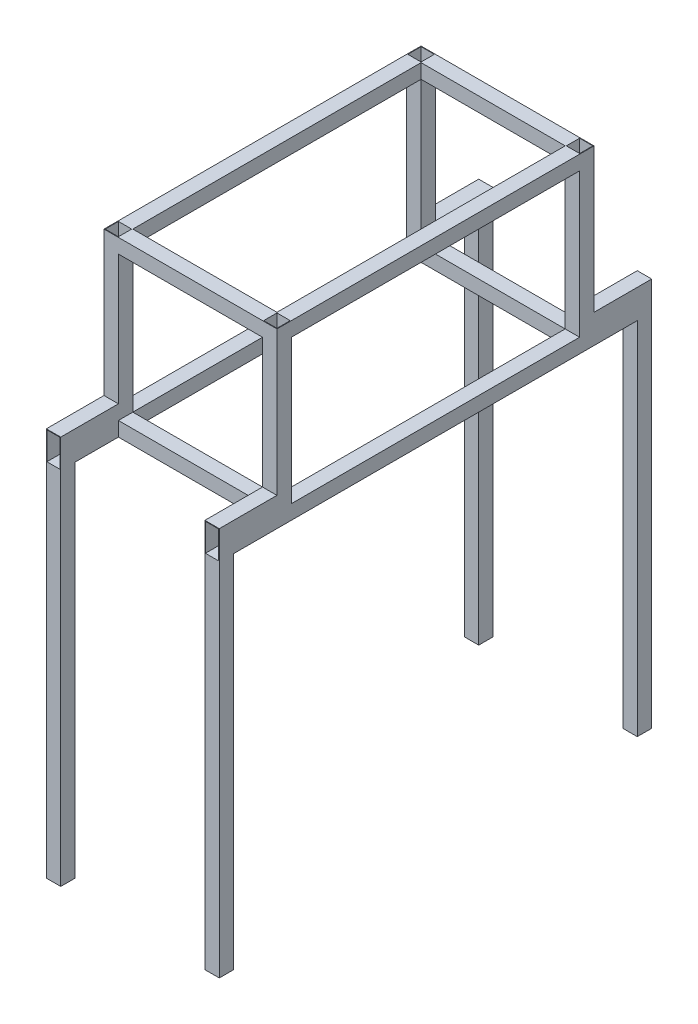
from build123d import *

# Parameters (mm, degrees)
SKETCH1_W             = 25.4
SKETCH1_H             = 25.4
SKETCH1_W_2           = 23.4
SKETCH1_H_2           = 23.4
BOSS_EXTRUDE1_DEPTH   = 304.8
BOSS_EXTRUDE1_2_DEPTH = 304.8
BOSS_EXTRUDE1_3_DEPTH = 304.8
BOSS_EXTRUDE1_4_DEPTH = 304.8
SKETCH2_W             = 25.4
SKETCH2_H             = 25.4
SKETCH2_W_2           = 23.4
SKETCH2_H_2           = 23.4
BOSS_EXTRUDE2_DEPTH   = 508
SKETCH3_W             = 25.4
SKETCH3_H             = 25.4
SKETCH3_W_2           = 23.4
SKETCH3_H_2           = 23.4
BOSS_EXTRUDE4_DEPTH   = 254
LPATTERN2_COUNT       = 2
LPATTERN2_PITCH       = 279.4
SKETCH4_W             = 25.4
SKETCH4_H             = 50.8
SKETCH4_W_2           = 23.4
SKETCH4_H_2           = 48.8
BOSS_EXTRUDE5_DEPTH   = 101.6
SKETCH5_W             = 25.4
SKETCH5_H             = 25.4
SKETCH5_W_2           = 23.4
SKETCH5_H_2           = 23.4
BOSS_EXTRUDE6_DEPTH   = 635
LPATTERN3_COUNT       = 2
LPATTERN3_PITCH       = 660.4
LPATTERN4_COUNT       = 2
LPATTERN4_PITCH       = 736.6


with BuildPart() as part:
    # Sketch1 → Boss-Extrude1 (new body)
    with BuildSketch(Plane(origin=(0, 0, 0), x_dir=(1, 0, 0), z_dir=(0, 1, 0))):
        with Locations((139.7, 266.7)):
            Rectangle(SKETCH1_W, SKETCH1_H)
        with Locations((139.7, 266.7)):
            Rectangle(SKETCH1_W_2, SKETCH1_H_2, mode=Mode.SUBTRACT)
    extrude(amount=BOSS_EXTRUDE1_DEPTH)



with BuildPart() as body_2:
    # Sketch1 → Boss-Extrude1 2 (new body)
    with BuildSketch(Plane(origin=(0, 0, 0), x_dir=(1, 0, 0), z_dir=(0, 1, 0))):
        with Locations((139.7, -266.7)):
            Rectangle(SKETCH1_W, SKETCH1_H)
        with Locations((139.7, -266.7)):
            Rectangle(SKETCH1_W_2, SKETCH1_H_2, mode=Mode.SUBTRACT)
    extrude(amount=BOSS_EXTRUDE1_2_DEPTH)


with BuildPart() as body_3:
    # Sketch1 → Boss-Extrude1 3 (new body)
    with BuildSketch(Plane(origin=(0, 0, 0), x_dir=(1, 0, 0), z_dir=(0, 1, 0))):
        with Locations((-139.7, -266.7)):
            Rectangle(SKETCH1_W, SKETCH1_H)
        with Locations((-139.7, -266.7)):
            Rectangle(SKETCH1_W_2, SKETCH1_H_2, mode=Mode.SUBTRACT)
    extrude(amount=BOSS_EXTRUDE1_3_DEPTH)


with BuildPart() as body_4:
    # Sketch1 → Boss-Extrude1 4 (new body)
    with BuildSketch(Plane(origin=(0, 0, 0), x_dir=(1, 0, 0), z_dir=(0, 1, 0))):
        with Locations((-139.7, 266.7)):
            Rectangle(SKETCH1_W, SKETCH1_H)
        with Locations((-139.7, 266.7)):
            Rectangle(SKETCH1_W_2, SKETCH1_H_2, mode=Mode.SUBTRACT)
    extrude(amount=BOSS_EXTRUDE1_4_DEPTH)


with BuildPart() as part_1:
    add(part.part)

    add(body_2.part)  # Boss-Extrude2 merges body 2
    # Sketch2 → Boss-Extrude2 (add)
    # profile 1 of 2: a face of its own
    with BuildSketch(Plane.XY.offset(-254)):
        with Locations((139.7, 292.1)):
            Rectangle(SKETCH2_W, SKETCH2_H)
        with Locations((139.7, 292.1)):
            Rectangle(SKETCH2_W_2, SKETCH2_H_2, mode=Mode.SUBTRACT)
    # profile 2 of 2: a face of its own
    with BuildSketch(Plane.XY.offset(-254)):
        with Locations((139.7, 12.7)):
            Rectangle(SKETCH2_W, SKETCH2_H)
        with Locations((139.7, 12.7)):
            Rectangle(SKETCH2_W_2, SKETCH2_H_2, mode=Mode.SUBTRACT)
    boss_extrude2 = extrude(amount=BOSS_EXTRUDE2_DEPTH)


    add(body_3.part)  # Boss-Extrude4 merges body 3

    add(body_4.part)  # Boss-Extrude4 merges body 4
    # Sketch3 → Boss-Extrude4 (add)
    # profile 1 of 4: a face of its own
    with BuildSketch(Plane.ZY.offset(-127)):
        with Locations((266.7, 292.1)):
            Rectangle(SKETCH3_W, SKETCH3_H)
        with Locations((266.7, 292.1)):
            Rectangle(SKETCH3_W_2, SKETCH3_H_2, mode=Mode.SUBTRACT)
    # profile 2 of 4: a face of its own
    with BuildSketch(Plane.ZY.offset(-127)):
        with Locations((-266.7, 292.1)):
            Rectangle(SKETCH3_W, SKETCH3_H)
        with Locations((-266.7, 292.1)):
            Rectangle(SKETCH3_W_2, SKETCH3_H_2, mode=Mode.SUBTRACT)
    # profile 3 of 4: a face of its own
    with BuildSketch(Plane.ZY.offset(-127)):
        with Locations((266.7, 12.7)):
            Rectangle(SKETCH3_W, SKETCH3_H)
        with Locations((266.7, 12.7)):
            Rectangle(SKETCH3_W_2, SKETCH3_H_2, mode=Mode.SUBTRACT)
    # profile 4 of 4: a face of its own
    with BuildSketch(Plane.ZY.offset(-127)):
        with Locations((-266.7, 12.7)):
            Rectangle(SKETCH3_W, SKETCH3_H)
        with Locations((-266.7, 12.7)):
            Rectangle(SKETCH3_W_2, SKETCH3_H_2, mode=Mode.SUBTRACT)
    extrude(amount=BOSS_EXTRUDE4_DEPTH)

    # LPattern2: Boss-Extrude2 ×2
    with Locations(*[(-i * LPATTERN2_PITCH, 0, 0) for i in range(1, LPATTERN2_COUNT)]):
        add(boss_extrude2)

    # Sketch4 → Boss-Extrude5 (add)
    # profile 1 of 2: a face of its own
    with BuildSketch(Plane(origin=(0, 0, -279.4), x_dir=(-1, 0, 0), z_dir=(0, 0, -1))):
        with Locations((-139.7, 25.4)):
            Rectangle(SKETCH4_W, SKETCH4_H)
        with Locations((-139.7, 25.4)):
            Rectangle(SKETCH4_W_2, SKETCH4_H_2, mode=Mode.SUBTRACT)
    # profile 2 of 2: a face of its own
    with BuildSketch(Plane(origin=(0, 0, -279.4), x_dir=(-1, 0, 0), z_dir=(0, 0, -1))):
        with Locations((139.7, 25.4)):
            Rectangle(SKETCH4_W, SKETCH4_H)
        with Locations((139.7, 25.4)):
            Rectangle(SKETCH4_W_2, SKETCH4_H_2, mode=Mode.SUBTRACT)
    boss_extrude5 = extrude(amount=BOSS_EXTRUDE5_DEPTH)

    # Sketch5 → Boss-Extrude6 (add)
    # profile 1 of 2: a face of its own
    with BuildSketch(Plane.XZ):
        with Locations((-139.7, -368.3)):
            Rectangle(SKETCH5_W, SKETCH5_H)
        with Locations((-139.7, -368.3)):
            Rectangle(SKETCH5_W_2, SKETCH5_H_2, mode=Mode.SUBTRACT)
    # profile 2 of 2: a face of its own
    with BuildSketch(Plane.XZ):
        with Locations((139.7, -368.3)):
            Rectangle(SKETCH5_W, SKETCH5_H)
        with Locations((139.7, -368.3)):
            Rectangle(SKETCH5_W_2, SKETCH5_H_2, mode=Mode.SUBTRACT)
    boss_extrude6 = extrude(amount=BOSS_EXTRUDE6_DEPTH)

    # LPattern3: Boss-Extrude5 ×2
    with Locations(*[(0, 0, i * LPATTERN3_PITCH) for i in range(1, LPATTERN3_COUNT)]):
        add(boss_extrude5)

    # LPattern4: Boss-Extrude6 ×2
    with Locations(*[(0, 0, i * LPATTERN4_PITCH) for i in range(1, LPATTERN4_COUNT)]):
        add(boss_extrude6)


solid = part_1.part
